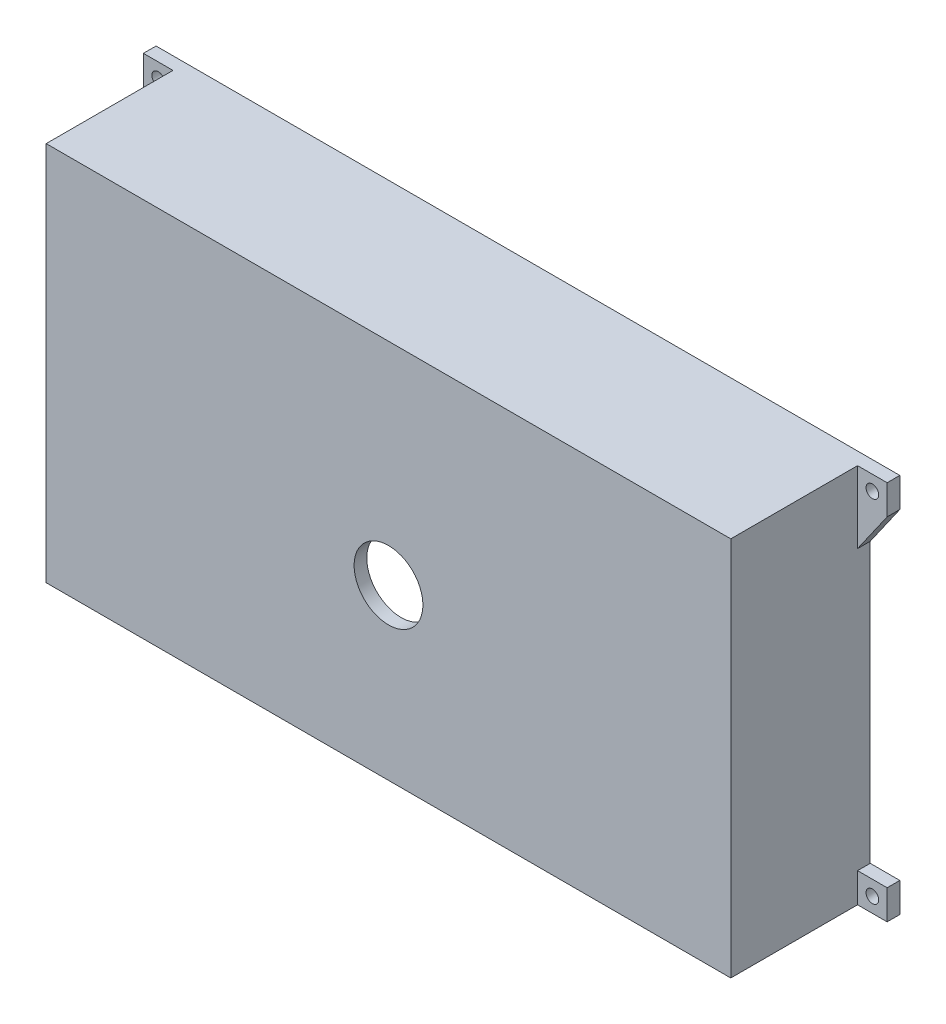
from build123d import *

# Parameters (mm, degrees)
BOSS_EXTRUDE1_DEPTH = 33
SKETCH1_4_W         = 7
SKETCH1_4_H         = 7
SKETCH1_4_R         = 1.5
BOSS_EXTRUDE2_DEPTH = 3
SKETCH3_W           = 156
SKETCH3_H           = 87
SKETCH3_R           = 8.137703122
CUT_EXTRUDE1_DEPTH  = 30
SKETCH3_2_R         = 8.137703122
CUT_EXTRUDE2_DEPTH  = 33


with BuildPart() as part:
    # Sketch1 → Boss-Extrude1 (new body)
    with BuildSketch(Plane.XY):
        Polygon((0, 7), (0, 0), (162, 0), (162, 7), (162, 73), (162, 83), (162, 90), (0, 90), (0, 83), (0, 73), align=None)
    extrude(amount=BOSS_EXTRUDE1_DEPTH)

    # Sketch1<4> → Boss-Extrude2 (add)
    # profile 1 of 4: a face of its own
    with BuildSketch(Plane.XY):
        with Locations((-3.5, 3.5)):
            Rectangle(SKETCH1_4_W, SKETCH1_4_H)
        with Locations((-3.5, 3.5)):
            Circle(SKETCH1_4_R, mode=Mode.SUBTRACT)
    # profile 2 of 4: a face of its own
    with BuildSketch(Plane.XY):
        with Locations((165.5, 3.5)):
            Rectangle(SKETCH1_4_W, SKETCH1_4_H)
        with Locations((165.5, 3.5)):
            Circle(SKETCH1_4_R, mode=Mode.SUBTRACT)
    # profile 3 of 4: a face of its own
    with BuildSketch(Plane.XY):
        Polygon((-7, 83), (0, 73), (0, 90), (-7, 90), align=None)
        with Locations((-3.5, 86.5)):
            Circle(SKETCH1_4_R, mode=Mode.SUBTRACT)
    # profile 4 of 4: a face of its own
    with BuildSketch(Plane.XY):
        Polygon((162, 90), (162, 73), (169, 83), (169, 90), align=None)
        with Locations((165.5, 86.5)):
            Circle(SKETCH1_4_R, mode=Mode.SUBTRACT)
    extrude(amount=BOSS_EXTRUDE2_DEPTH)

    # Sketch3 → Cut-Extrude1 (cut)
    with BuildSketch(Plane(origin=(0, 0, 0), x_dir=(-1, 0, 0), z_dir=(0, 0, -1))):
        with Locations((-81, 43.5)):
            Rectangle(SKETCH3_W, SKETCH3_H)
        with Locations((-81, 40)):
            Circle(SKETCH3_R, mode=Mode.SUBTRACT)
    extrude(amount=-CUT_EXTRUDE1_DEPTH, mode=Mode.SUBTRACT)

    # Sketch3<2> → Cut-Extrude2 (cut)
    with BuildSketch(Plane(origin=(0, 0, 0), x_dir=(-1, 0, 0), z_dir=(0, 0, -1))):
        with Locations((-81, 40)):
            Circle(SKETCH3_2_R)
    extrude(amount=-CUT_EXTRUDE2_DEPTH, mode=Mode.SUBTRACT)


solid = part.part
